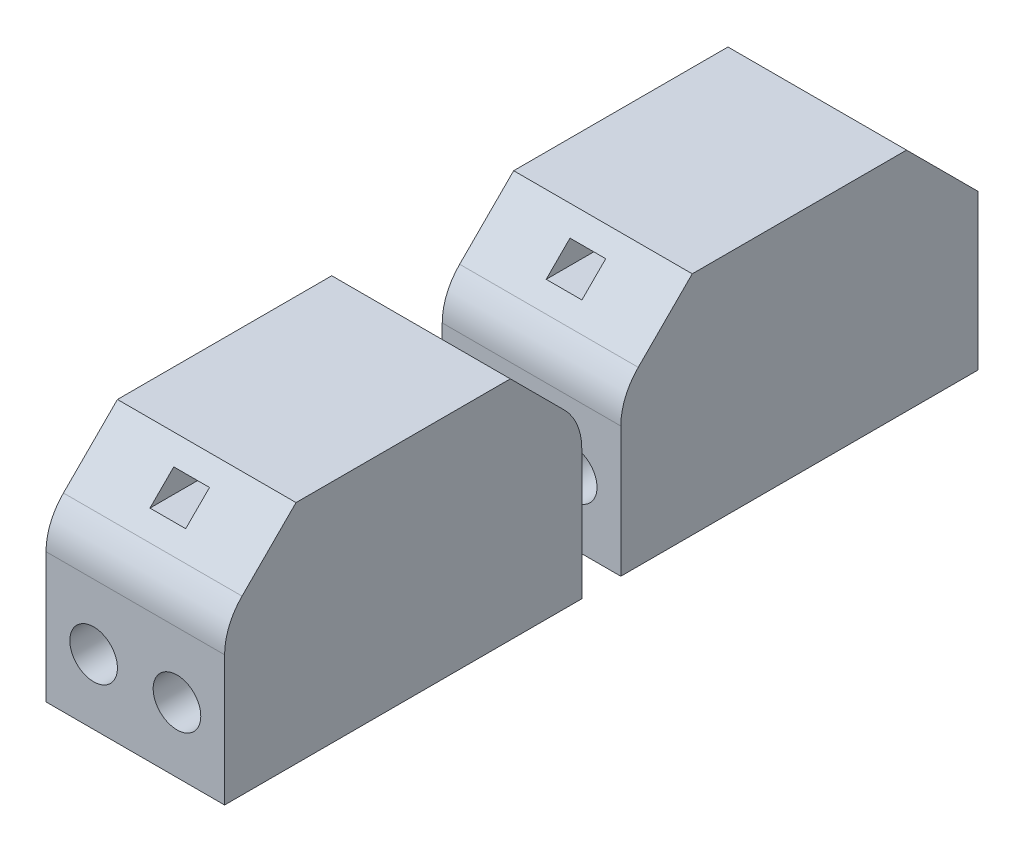
from build123d import *

# Parameters (mm, degrees)
BOSS_EXTRUDE2_DEPTH = 7.5
BOSS_EXTRUDE3_DEPTH = 7.5
FILLET1_R           = 5
FILLET2_R           = 5
SKETCH4_R           = 2
SKETCH4_W           = 3
SKETCH4_H           = 2
CUT_EXTRUDE1_DEPTH  = 100


with BuildPart() as part:
    # Sketch2 → Boss-Extrude2 (new, symmetric)
    with BuildSketch(Plane(origin=(0, 0, 0), x_dir=(0, 0, -1), z_dir=(1, 0, 0))):
        Polygon((-7.967160281, -29.21673477), (-7.967160281, -16.21673477), (-1.967160281, -10.21673477), (16.032839719, -10.21673477), (22.032839719, -16.21673477), (22.032839719, -29.21673477), align=None)
    extrude(amount=BOSS_EXTRUDE2_DEPTH, both=True)

    # Fillet2
    fillet2_edges = [part.edges().sort_by_distance(p)[0] for p in [
        (0, -16.21673477, 7.967160281),
        (0, -16.21673477, -22.032839719),
    ]]
    fillet(fillet2_edges, radius=FILLET2_R)


with BuildPart() as body_2:
    # Sketch3 → Boss-Extrude3 (new, symmetric)
    with BuildSketch(Plane(origin=(0, 0, 0), x_dir=(0, 0, -1), z_dir=(1, 0, 0))):
        Polygon((25.31118522, -16.21673477), (25.31118522, -29.21673477), (55.31118522, -29.21673477), (55.31118522, -16.21673477), (49.31118522, -10.21673477), (31.31118522, -10.21673477), align=None)
    extrude(amount=BOSS_EXTRUDE3_DEPTH, both=True)

    # Fillet1
    fillet1_edges = [body_2.edges().sort_by_distance(p)[0] for p in [
        (0, -16.21673477, -25.31118522),
    ]]
    fillet(fillet1_edges, radius=FILLET1_R)


with BuildPart() as cut_extrude1_tool:
    # Sketch4 → Cut-Extrude1 (new, symmetric)
    with BuildSketch(Plane.XY):
        with Locations((-3.5, -23.752268676)):
            Circle(SKETCH4_R)
        with Locations((3.5, -23.752268676)):
            Circle(SKETCH4_R)
        with Locations((0, -12.484501723)):
            Rectangle(SKETCH4_W, SKETCH4_H)
    extrude(amount=CUT_EXTRUDE1_DEPTH, both=True)


with BuildPart() as part_1:
    add(part.part)

    # Cut-Extrude1: cut by cut_extrude1_tool
    add(cut_extrude1_tool.part, mode=Mode.SUBTRACT)


with BuildPart() as body_2_1:
    add(body_2.part)

    # Cut-Extrude1: cut by cut_extrude1_tool
    add(cut_extrude1_tool.part, mode=Mode.SUBTRACT)


solid = Compound([part_1.part, body_2_1.part])
